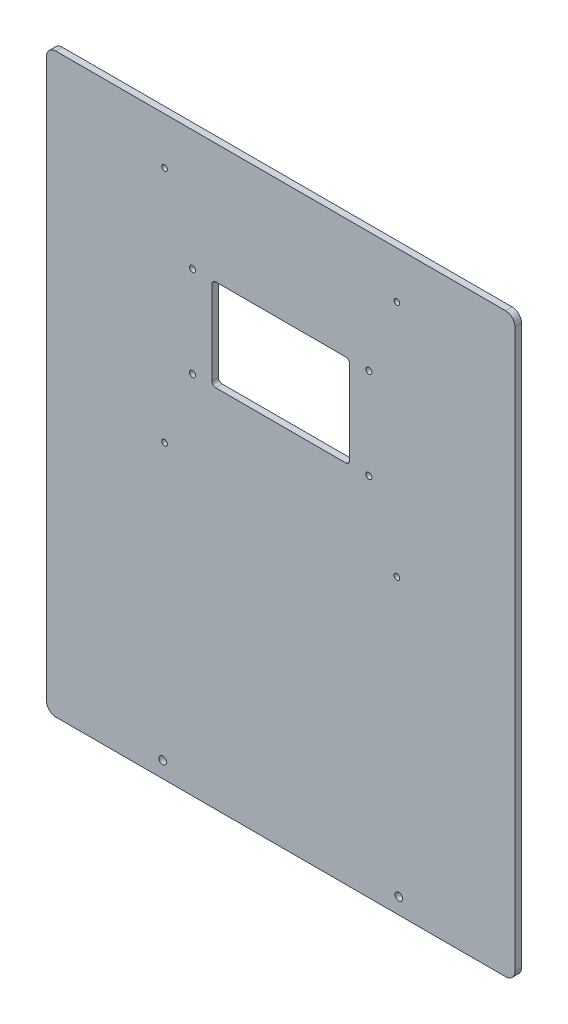
from build123d import *

# Parameters (mm, degrees)
BOSS_EXTRU_1_DEPTH      = 3.5
ESQUISSE2_R             = 2
ENL_V_MAT_EXTRU_1_DEPTH = 397.559259254
ESQUISSE3_R             = 1.5
ESQUISSE3_R_2           = 1.6
ENL_V_MAT_EXTRU_2_DEPTH = 397.559259254
ENL_V_MAT_EXTRU_3_DEPTH = 397.559259254


with BuildPart() as part:
    # Esquisse1 → Boss.-Extru.1 (new body)
    with BuildSketch(Plane.XY):
        with BuildLine():
            Line((5, 0), (245, 0))
            ThreePointArc((245, 0), (248.535533906, 1.464466094), (250, 5))
            Line((250, 5), (250, 302.81))
            ThreePointArc((250, 302.81), (248.535533906, 306.345533906), (245, 307.81))
            Line((245, 307.81), (5, 307.81))
            ThreePointArc((5, 307.81), (1.464466094, 306.345533906), (0, 302.81))
            Line((0, 302.81), (0, 5))
            ThreePointArc((0, 5), (1.464466094, 1.464466094), (5, 0))
        make_face()
    extrude(amount=BOSS_EXTRU_1_DEPTH)

    # Esquisse2 → Enlèv. mat.-Extru.1 (cut, through all)
    with BuildSketch(Plane.XY.offset(3.5)):
        with Locations((62, 8.5)):
            Circle(ESQUISSE2_R)
        with Locations((188, 8.5)):
            Circle(ESQUISSE2_R)
    extrude(amount=-ENL_V_MAT_EXTRU_1_DEPTH, mode=Mode.SUBTRACT)

    # Esquisse3 → Enlèv. mat.-Extru.2 (cut, through all)
    with BuildSketch(Plane.XY.offset(3.5)):
        with Locations((63, 155.81)):
            Circle(ESQUISSE3_R)
        with Locations((63, 282.81)):
            Circle(ESQUISSE3_R)
        with Locations((187, 282.81)):
            Circle(ESQUISSE3_R)
        with Locations((187, 155.81)):
            Circle(ESQUISSE3_R)
        with Locations((77.95, 243.58)):
            Circle(ESQUISSE3_R_2)
        with Locations((172.05, 243.58)):
            Circle(ESQUISSE3_R_2)
        with Locations((77.95, 195.04)):
            Circle(ESQUISSE3_R_2)
        with Locations((172.05, 195.04)):
            Circle(ESQUISSE3_R_2)
    extrude(amount=-ENL_V_MAT_EXTRU_2_DEPTH, mode=Mode.SUBTRACT)

    # Esquisse4 → Enlèv. mat.-Extru.3 (cut, through all)
    with BuildSketch(Plane.XY.offset(3.5)):
        with BuildLine():
            Line((90.28, 243.79), (159.72, 243.79))
            ThreePointArc((159.72, 243.79), (161.134213562, 243.204213562), (161.72, 241.79))
            Line((161.72, 241.79), (161.72, 196.83))
            ThreePointArc((161.72, 196.83), (161.134213562, 195.415786438), (159.72, 194.83))
            Line((159.72, 194.83), (90.28, 194.83))
            ThreePointArc((90.28, 194.83), (88.865786438, 195.415786438), (88.28, 196.83))
            Line((88.28, 196.83), (88.28, 241.79))
            ThreePointArc((88.28, 241.79), (88.865786438, 243.204213562), (90.28, 243.79))
        make_face()
    extrude(amount=-ENL_V_MAT_EXTRU_3_DEPTH, mode=Mode.SUBTRACT)


solid = part.part
